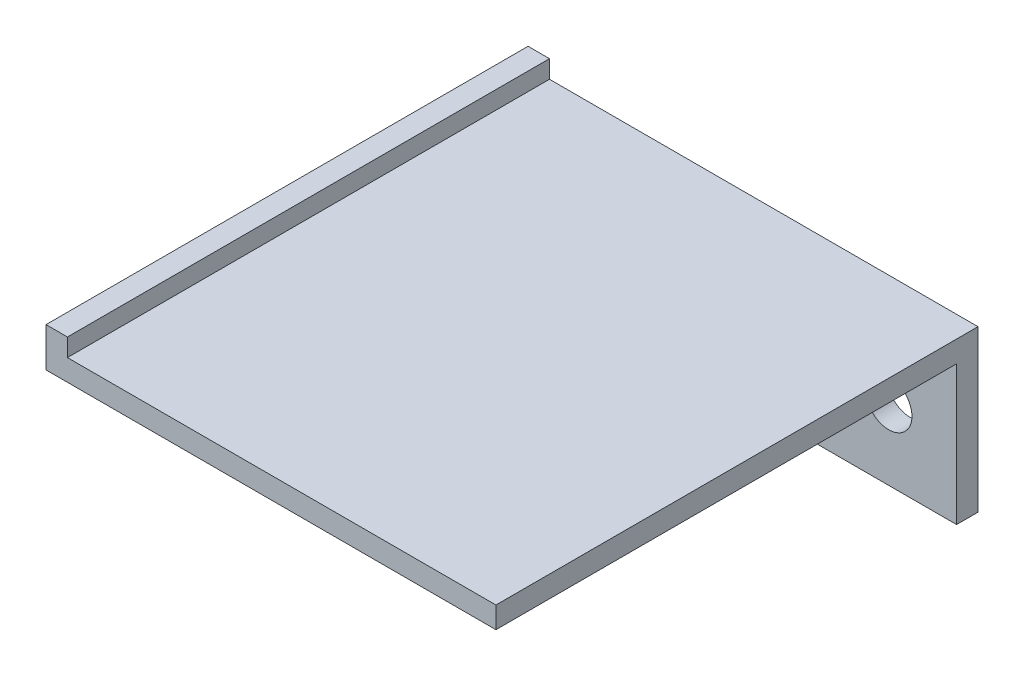
from build123d import *

# Parameters (mm, degrees)
SKETCH_1_W          = 240
SKETCH_1_H          = 270
EXTRUDE_1_DEPTH     = 12
SKETCH_2_W          = 270
SKETCH_2_H          = 100
EXTRUDE_2_DEPTH     = 12
SKETCH_3_W          = 12
SKETCH_3_H          = 78
EXTRUDE_3_DEPTH     = 240
SKETCH_4_R          = 13
CUT_EXTRUDE_1_DEPTH = 361.898877804
SKETCH_5_R          = 13
CUT_EXTRUDE_2_DEPTH = 378.475827041


with BuildPart() as part:
    # 草图1 → 凸台-拉伸1 (new body)
    with BuildSketch(Plane(origin=(0, 0, 0), x_dir=(1, 0, 0), z_dir=(0, 1, 0))):
        with Locations((120, 135)):
            Rectangle(SKETCH_1_W, SKETCH_1_H)
    extrude(amount=EXTRUDE_1_DEPTH)

    # 草图2 → 凸台-拉伸2 (add)
    with BuildSketch(Plane.ZY):
        with Locations((-135, -28)):
            Rectangle(SKETCH_2_W, SKETCH_2_H)
    extrude(amount=EXTRUDE_2_DEPTH)

    # 草图3 → 凸台-拉伸3 (add)
    with BuildSketch(Plane(origin=(0, 0, 0), x_dir=(0, 0, -1), z_dir=(1, 0, 0))):
        with Locations((264, -39)):
            Rectangle(SKETCH_3_W, SKETCH_3_H)
    extrude(amount=EXTRUDE_3_DEPTH)

    # 草图4 → 切除-拉伸1 (cut, through all)
    with BuildSketch(Plane.XY.offset(-258)):
        with Locations((82, -38)):
            Circle(SKETCH_4_R)
        with Locations((202, -38)):
            Circle(SKETCH_4_R)
    extrude(amount=-CUT_EXTRUDE_1_DEPTH, mode=Mode.SUBTRACT)

    # 草图5 → 切除-拉伸2 (cut, through all)
    with BuildSketch(Plane.ZY.offset(12)):
        with Locations((-217, -38)):
            Circle(SKETCH_5_R)
        with Locations((-137, -38)):
            Circle(SKETCH_5_R)
        Polygon((-100, -78), (0, 0), (0, -78), align=None)
    extrude(amount=-CUT_EXTRUDE_2_DEPTH, mode=Mode.SUBTRACT)


solid = part.part
